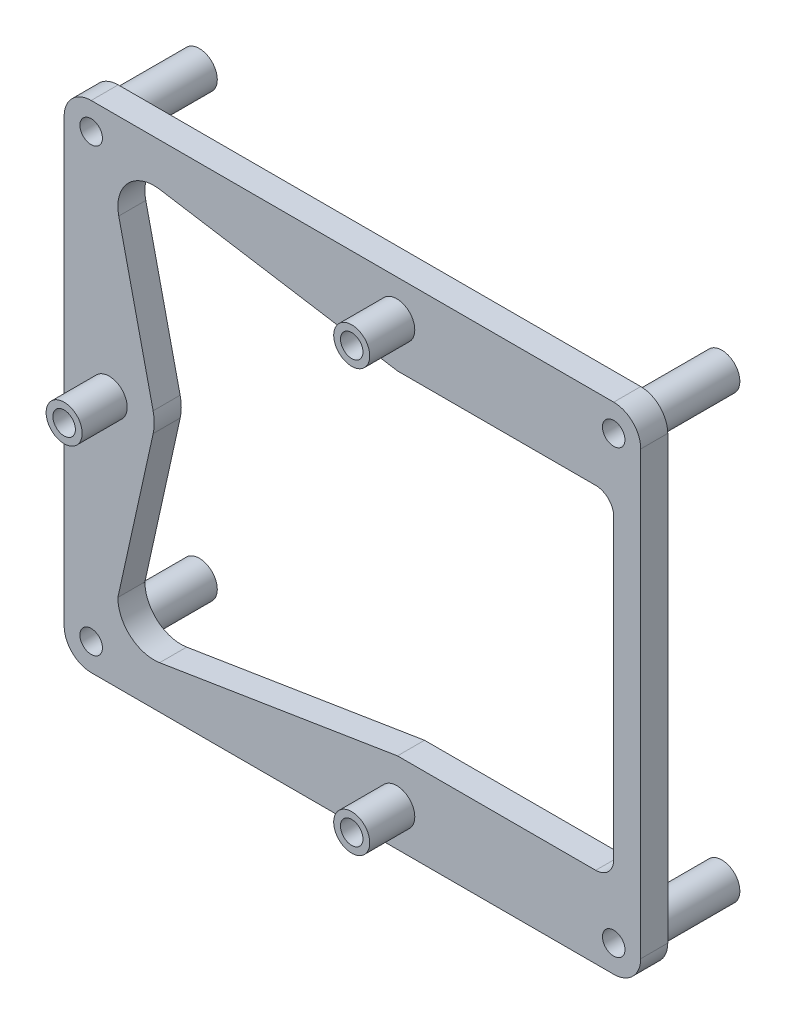
from build123d import *

# Parameters (mm, degrees)
SALIENTE_EXTRUIR2_DEPTH = 3
CROQUIS2_R              = 1.25
CORTAR_EXTRUIR4_DEPTH   = 5
SALIENTE_EXTRUIR5_START = 9
CROQUIS6_R              = 2
CROQUIS6_R_2            = 1.25
SALIENTE_EXTRUIR5_DEPTH = 9
CROQUIS4_R              = 2
CROQUIS4_R_2            = 1.25
SALIENTE_EXTRUIR4_DEPTH = 5
CORTAR_EXTRUIR5_DEPTH   = 7
REDONDEO1_R             = 2


with BuildPart() as part:
    # Croquis1 → Saliente-Extruir2 (new body)
    with BuildSketch(Plane.XY):
        with BuildLine():
            Line((21.769230769, 25.846153846), (-36.230769231, 25.846153846))
            ThreePointArc((-36.230769231, 25.846153846), (-38.352089574, 24.96747419), (-39.230769231, 22.846153846))
            Line((-39.230769231, 22.846153846), (-39.230769231, -26.153846154))
            ThreePointArc((-39.230769231, -26.153846154), (-38.352089574, -28.275166497), (-36.230769231, -29.153846154))
            Line((-36.230769231, -29.153846154), (21.769230769, -29.153846154))
            ThreePointArc((21.769230769, -29.153846154), (23.890551113, -28.275166497), (24.769230769, -26.153846154))
            Line((24.769230769, -26.153846154), (24.769230769, 22.846153846))
            ThreePointArc((24.769230769, 22.846153846), (23.890551113, 24.96747419), (21.769230769, 25.846153846))
        make_face()
    extrude(amount=SALIENTE_EXTRUIR2_DEPTH)

    # Croquis2 → Cortar-Extruir4 (cut)
    with BuildSketch(Plane(origin=(0, 0, 0), x_dir=(-1, 0, 0), z_dir=(0, 0, -1))):
        with Locations((-21.769230769, 22.846153846)):
            Circle(CROQUIS2_R)
        with Locations((36.230769231, 22.846153846)):
            Circle(CROQUIS2_R)
        with Locations((36.230769231, -26.153846154)):
            Circle(CROQUIS2_R)
        with Locations((-21.769230769, -26.153846154)):
            Circle(CROQUIS2_R)
    extrude(amount=-CORTAR_EXTRUIR4_DEPTH, mode=Mode.SUBTRACT)

    # Croquis6 → Saliente-Extruir5 (add)
    # profile 1 of 4: a face of its own
    with BuildSketch(Plane(origin=(0, 0, 0), x_dir=(-1, 0, 0), z_dir=(0, 0, -1)).offset(SALIENTE_EXTRUIR5_START)):
        with Locations(Location((-21.769230769, 22.846153846, 0), (0, 0, 180))):
            Circle(CROQUIS6_R)
        with Locations((-21.769230769, 22.846153846)):
            Circle(CROQUIS6_R_2, mode=Mode.SUBTRACT)
    # profile 2 of 4: a face of its own
    with BuildSketch(Plane(origin=(0, 0, 0), x_dir=(-1, 0, 0), z_dir=(0, 0, -1)).offset(SALIENTE_EXTRUIR5_START)):
        with Locations(Location((36.230769231, 22.846153846, 0), (0, 0, 180))):
            Circle(CROQUIS6_R)
        with Locations((36.230769231, 22.846153846)):
            Circle(CROQUIS6_R_2, mode=Mode.SUBTRACT)
    # profile 3 of 4: a face of its own
    with BuildSketch(Plane(origin=(0, 0, 0), x_dir=(-1, 0, 0), z_dir=(0, 0, -1)).offset(SALIENTE_EXTRUIR5_START)):
        with Locations(Location((36.230769231, -26.153846154, 0), (0, 0, 180))):
            Circle(CROQUIS6_R)
        with Locations((36.230769231, -26.153846154)):
            Circle(CROQUIS6_R_2, mode=Mode.SUBTRACT)
    # profile 4 of 4: a face of its own
    with BuildSketch(Plane(origin=(0, 0, 0), x_dir=(-1, 0, 0), z_dir=(0, 0, -1)).offset(SALIENTE_EXTRUIR5_START)):
        with Locations(Location((-21.769230769, -26.153846154, 0), (0, 0, 180))):
            Circle(CROQUIS6_R)
        with Locations((-21.769230769, -26.153846154)):
            Circle(CROQUIS6_R_2, mode=Mode.SUBTRACT)
    extrude(amount=-SALIENTE_EXTRUIR5_DEPTH)

    # Croquis4 → Saliente-Extruir4 (add)
    # profile 1 of 3: a face of its own
    with BuildSketch(Plane.XY.offset(3)):
        with Locations((-34.230769231, -1.653846154)):
            Circle(CROQUIS4_R)
        with Locations((-34.230769231, -1.653846154)):
            Circle(CROQUIS4_R_2, mode=Mode.SUBTRACT)
    # profile 2 of 3: a face of its own
    with BuildSketch(Plane.XY.offset(3)):
        with Locations((-2.310769231, 21.746153846)):
            Circle(CROQUIS4_R)
        with Locations((-2.310769231, 21.746153846)):
            Circle(CROQUIS4_R_2, mode=Mode.SUBTRACT)
    # profile 3 of 3: a face of its own
    with BuildSketch(Plane.XY.offset(3)):
        with Locations((-2.310769231, -25.053846154)):
            Circle(CROQUIS4_R)
        with Locations((-2.310769231, -25.053846154)):
            Circle(CROQUIS4_R_2, mode=Mode.SUBTRACT)
    extrude(amount=SALIENTE_EXTRUIR4_DEPTH)

    # Croquis5 → Cortar-Extruir5 (cut)
    with BuildSketch(Plane.XY.offset(3)):
        with BuildLine():
            Line((21.769230769, 16.846153846), (-2.230769231, 16.846153846))
            Line((-2.230769231, 16.846153846), (-28.630769231, 21.10260022))
            ThreePointArc((-28.630769231, 21.10260022), (-32.183785013, 19.891309577), (-33.168405876, 16.268925289))
            Line((-33.168405876, 16.268925289), (-29.35459073, -0.548005648))
            ThreePointArc((-29.35459073, -0.548005648), (-29.230786857, -1.640569852), (-29.34878692, -2.733776112))
            Line((-29.34878692, -2.733776112), (-32.894263486, -18.761624723))
            Line((-32.894263486, -18.761624723), (-33.267463075, -20.448728388))
            ThreePointArc((-33.267463075, -20.448728388), (-31.861740508, -23.49335063), (-28.632600775, -24.398025776))
            Line((-28.632600775, -24.398025776), (-2.230769231, -20.153846154))
            Line((-2.230769231, -20.153846154), (21.769230769, -20.153846154))
            Line((21.769230769, -20.153846154), (21.769230769, 16.846153846))
        make_face()
    extrude(amount=-CORTAR_EXTRUIR5_DEPTH, mode=Mode.SUBTRACT)

    # Redondeo1
    redondeo1_edges = [part.edges().sort_by_distance(p)[0] for p in [
        (21.769230769, 16.846153846, 1.5),
        (21.769230769, -20.153846154, 1.5),
    ]]
    fillet(redondeo1_edges, radius=REDONDEO1_R)


solid = part.part
